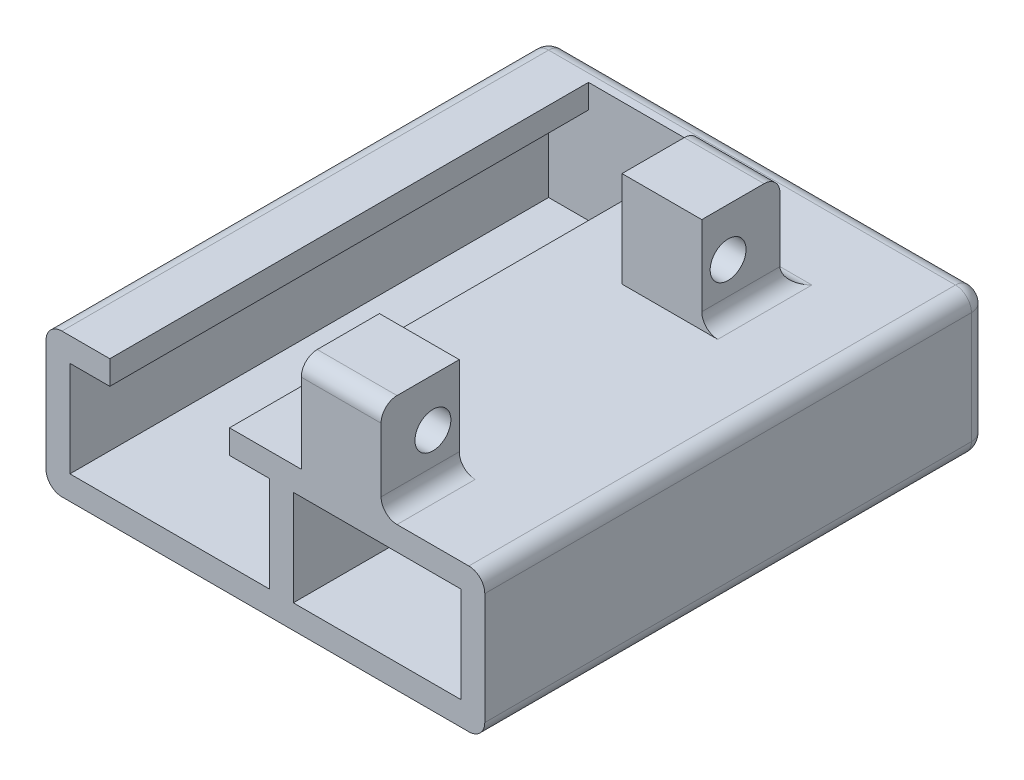
from build123d import *

# Parameters (mm, degrees)
SKETCH1_W           = 21
SKETCH1_H           = 12
BOSS_EXTRUDE1_DEPTH = 60
SKETCH2_R           = 2.25
BOSS_EXTRUDE2_DEPTH = 10
SKETCH3_W           = 55
SKETCH3_H           = 18
BOSS_EXTRUDE3_DEPTH = 3
FILLET1_R           = 2


with BuildPart() as part:
    # Sketch1 → Boss-Extrude1 (new body)
    with BuildSketch(Plane.XY):
        Polygon((17.509291985, 21.588576814), (-9.490708015, 21.588576814), (-14.490708015, 21.588576814), (-14.490708015, 18.588576814), (-9.490708015, 18.588576814), (-9.490708015, 6.588576814), (-34.490708015, 6.588576814), (-34.490708015, 18.588576814), (-29.490708015, 18.588576814), (-29.490708015, 21.588576814), (-34.490708015, 21.588576814), (-37.490708015, 21.588576814), (-37.490708015, 3.588576814), (17.509291985, 3.588576814), align=None)
        with Locations((4.009291985, 12.588576814)):
            Rectangle(SKETCH1_W, SKETCH1_H, mode=Mode.SUBTRACT)
    extrude(amount=-BOSS_EXTRUDE1_DEPTH)

    # Sketch2 → Boss-Extrude2 (add)
    # profile 1 of 2: a face of its own
    with BuildSketch(Plane(origin=(-5.490708015, 0, 0), x_dir=(0, 0, -1), z_dir=(1, 0, 0))):
        with BuildLine():
            Line((50, 21.588576814), (40.2, 21.588576814))
            Line((40.2, 21.588576814), (40.2, 33.588576814))
            Line((40.2, 33.588576814), (48, 33.588576814))
            ThreePointArc((48, 33.588576814), (49.414213562, 33.002790376), (50, 31.588576814))
            Line((50, 31.588576814), (50, 21.588576814))
        make_face()
        with Locations(Location((43.5, 27.588576814, 0), (0, 0, 90))):
            Circle(SKETCH2_R, mode=Mode.SUBTRACT)
    # profile 2 of 2: a face of its own
    with BuildSketch(Plane(origin=(-5.490708015, 0, 0), x_dir=(0, 0, -1), z_dir=(1, 0, 0))):
        with BuildLine():
            Line((9.8, 21.588576814), (0, 21.588576814))
            Line((0, 21.588576814), (0, 31.588576814))
            ThreePointArc((0, 31.588576814), (0.585786438, 33.002790376), (2, 33.588576814))
            Line((2, 33.588576814), (9.8, 33.588576814))
            Line((9.8, 33.588576814), (9.8, 21.588576814))
        make_face()
        with Locations(Location((6.5, 27.588576814, 0), (0, 0, 90))):
            Circle(SKETCH2_R, mode=Mode.SUBTRACT)
    extrude(amount=BOSS_EXTRUDE2_DEPTH)

    # Sketch3 → Boss-Extrude3 (add)
    with BuildSketch(Plane(origin=(0, 0, -60), x_dir=(-1, 0, 0), z_dir=(0, 0, -1))):
        with Locations((9.990708015, 12.588576814)):
            Rectangle(SKETCH3_W, SKETCH3_H)
    extrude(amount=BOSS_EXTRUDE3_DEPTH)

    # Fillet1
    fillet1_edges = [part.edges().sort_by_distance(p)[0] for p in [
        (17.509291985, 3.588576814, -31.5),
        (-37.490708015, 3.588576814, -31.5),
        (-37.490708015, 21.588576814, -31.5),
        (17.509291985, 21.588576814, -31.5),
        (4.509291985, 21.588576814, -45.1),
        (-0.490708015, 21.588576814, -50),
        (4.509291985, 21.588576814, -4.9),
        (17.509291985, 12.588576814, -63),
        (-9.990708015, 3.588576814, -63),
        (-37.490708015, 12.588576814, -63),
        (-9.990708015, 21.588576814, -63),
    ]]
    fillet(fillet1_edges, radius=FILLET1_R)


solid = part.part
